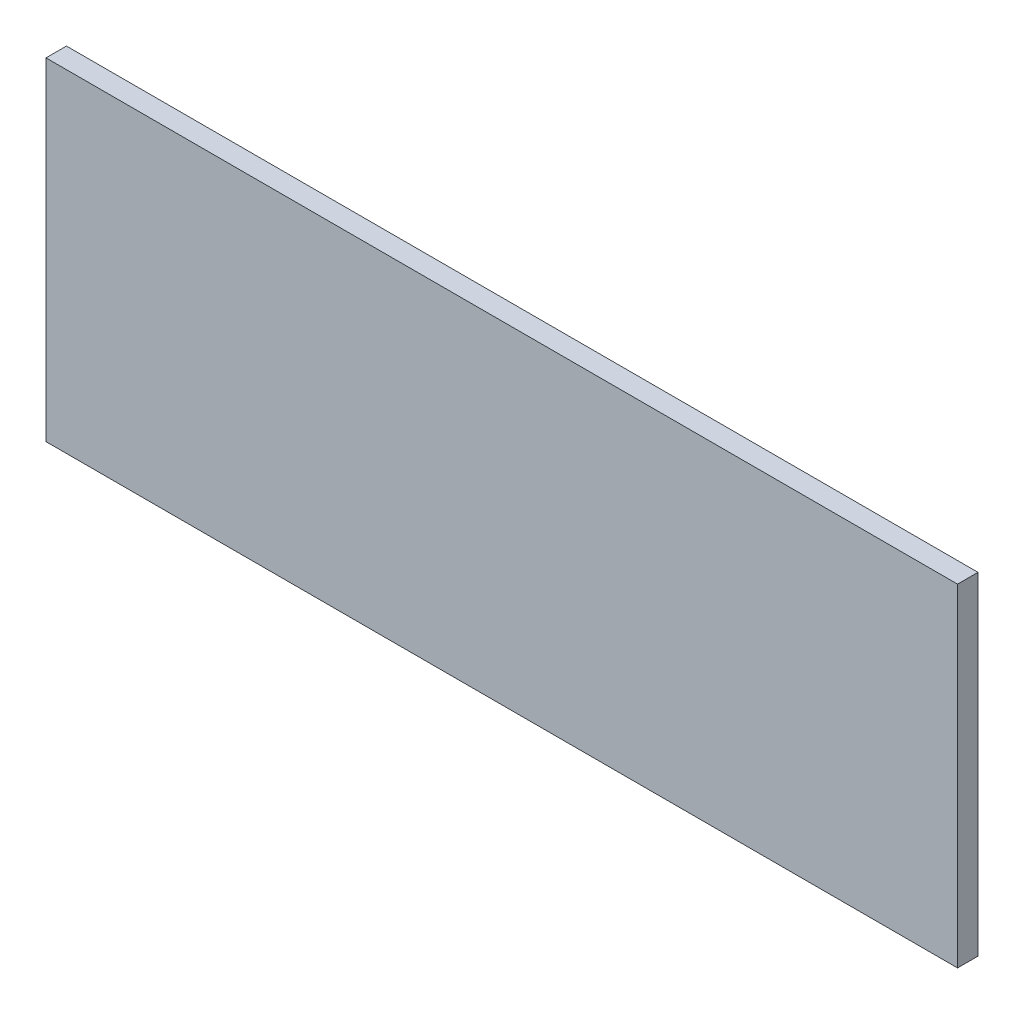
from build123d import *

# Parameters (mm, degrees)
SKETCH_1_W      = 713
SKETCH_1_H      = 260
EXTRUDE_1_DEPTH = 16


with BuildPart() as part:
    # 草图1 → 凸台-拉伸1 (new body)
    with BuildSketch(Plane.XY):
        Rectangle(SKETCH_1_W, SKETCH_1_H)
    extrude(amount=EXTRUDE_1_DEPTH)


solid = part.part
